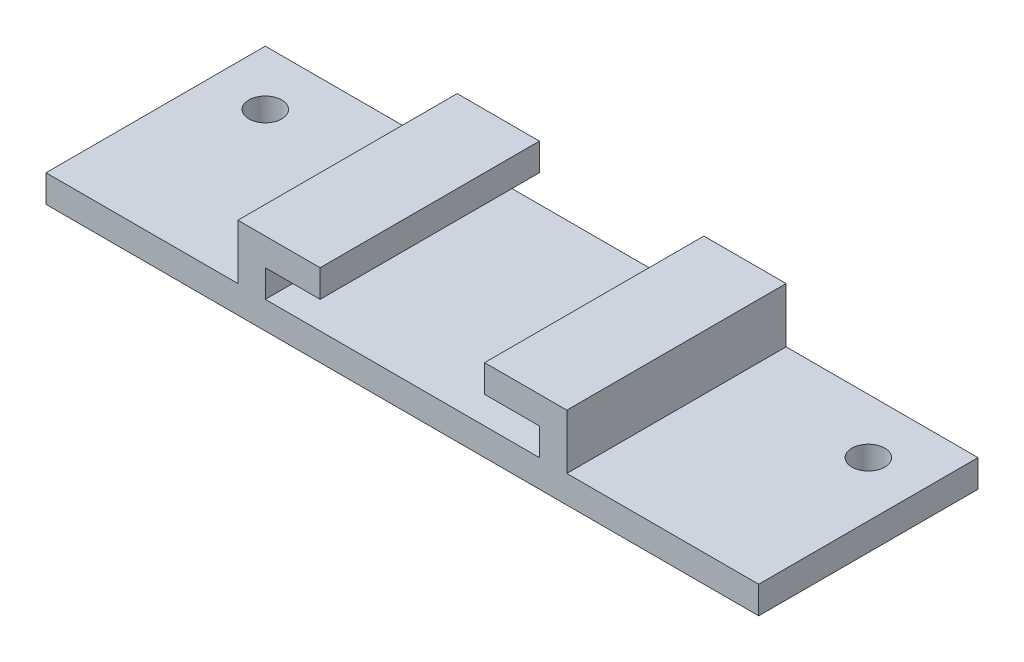
from build123d import *

# Parameters (mm, degrees)
SKETCH1_W             = 260
SKETCH1_H             = 80
BOSS_EXTRUDE1_DEPTH   = 10
EXTRUDE_THIN2_DEPTH   = 80
F_1_0MM_DOWEL_HOLE1_D = 12


with BuildPart() as part:
    # Sketch1 → Boss-Extrude1 (new body)
    with BuildSketch(Plane(origin=(0, 0, 0), x_dir=(1, 0, 0), z_dir=(0, 1, 0))):
        Rectangle(SKETCH1_W, SKETCH1_H)
    extrude(amount=BOSS_EXTRUDE1_DEPTH)

    # Sketch2 → Extrude-Thin2 (add)
    with BuildSketch(Plane.XY.offset(40)):
        Polygon((-30, 30), (-60, 30), (-60, 0), (60, 0), (60, 30), (30, 30), (30, 20), (50, 20), (50, 10), (-50, 10), (-50, 20), (-30, 20), align=None)
    extrude(amount=-EXTRUDE_THIN2_DEPTH)

    # Ø1.0mm Dowel Hole1 (through all)
    with Locations(Plane(origin=(-110, 10, -20), x_dir=(0, 0, 1), z_dir=(0, 1, 0))):
        with Locations((0, 0), (0, 220)):
            Hole(F_1_0MM_DOWEL_HOLE1_D / 2)


solid = part.part
